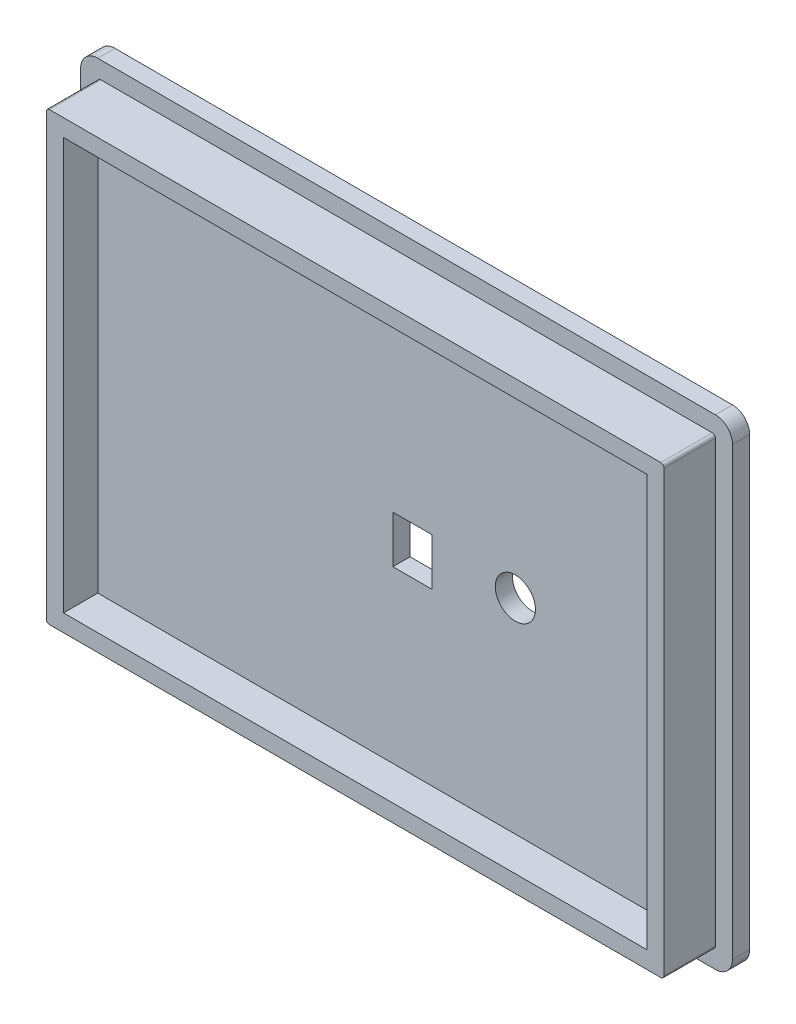
from build123d import *

# Parameters (mm, degrees)
SKETCH1_W           = 190
SKETCH1_H           = 140
BOSS_EXTRUDE1_DEPTH = 5
SKETCH2_W           = 160
SKETCH2_H           = 104
CUT_EXTRUDE1_DEPTH  = 5
SKETCH3_W           = 180
SKETCH3_H           = 130
BOSS_EXTRUDE2_DEPTH = 15
SKETCH4_W           = 170
SKETCH4_H           = 120
CUT_EXTRUDE2_DEPTH  = 10
FILLET1_R           = 0.9
FILLET2_R           = 0.9
SKETCH5_R           = 5.850988458
SKETCH5_W           = 11.444331631
SKETCH5_H           = 13.771992302
CUT_EXTRUDE3_DEPTH  = 10
FILLET3_R           = 5


with BuildPart() as part:
    # Sketch1 → Boss-Extrude1 (new body)
    with BuildSketch(Plane.XY):
        with Locations((-8.247588424, 0.40192926)):
            Rectangle(SKETCH1_W, SKETCH1_H)
    extrude(amount=BOSS_EXTRUDE1_DEPTH)

    # Sketch2 → Cut-Extrude1 (cut)
    with BuildSketch(Plane(origin=(0, 0, 0), x_dir=(-1, 0, 0), z_dir=(0, 0, -1))):
        with Locations((8.247588424, 0.40192926)):
            Rectangle(SKETCH2_W, SKETCH2_H)
    extrude(amount=-CUT_EXTRUDE1_DEPTH, mode=Mode.SUBTRACT)

    # Sketch3 → Boss-Extrude2 (add)
    with BuildSketch(Plane.XY.offset(5)):
        with Locations((-8.247588424, 0.40192926)):
            Rectangle(SKETCH3_W, SKETCH3_H)
    extrude(amount=BOSS_EXTRUDE2_DEPTH)

    # Sketch4 → Cut-Extrude2 (cut)
    with BuildSketch(Plane.XY.offset(20)):
        with Locations((-8.247588424, 0.40192926)):
            Rectangle(SKETCH4_W, SKETCH4_H)
    extrude(amount=-CUT_EXTRUDE2_DEPTH, mode=Mode.SUBTRACT)

    # Fillet1
    fillet1_edges = [part.edges().sort_by_distance(p)[0] for p in [
        (71.752411576, 0.40192926, 0),
        (-8.247588424, -51.59807074, 0),
        (-88.247588424, 0.40192926, 0),
        (-8.247588424, 52.40192926, 0),
    ]]
    fillet(fillet1_edges, radius=FILLET1_R)

    # Fillet2
    fillet2_edges = [part.edges().sort_by_distance(p)[0] for p in [
        (-98.247588424, 65.40192926, 12.5),
        (-98.247588424, -64.59807074, 12.5),
        (81.752411576, -64.59807074, 12.5),
        (81.752411576, 65.40192926, 12.5),
    ]]
    fillet(fillet2_edges, radius=FILLET2_R)

    # Sketch5 → Cut-Extrude3 (cut)
    with BuildSketch(Plane(origin=(0, 0, 5), x_dir=(-1, 0, 0), z_dir=(0, 0, -1))):
        with Locations((-28.456331926, 0)):
            Circle(SKETCH5_R)
        with Locations((1.51229921, -3.046296959)):
            Rectangle(SKETCH5_W, SKETCH5_H)
    extrude(amount=-CUT_EXTRUDE3_DEPTH, mode=Mode.SUBTRACT)

    # Fillet3
    fillet3_edges = [part.edges().sort_by_distance(p)[0] for p in [
        (-103.247588424, 70.40192926, 2.5),
        (86.752411576, 70.40192926, 2.5),
        (86.752411576, -69.59807074, 2.5),
        (-103.247588424, -69.59807074, 2.5),
    ]]
    fillet(fillet3_edges, radius=FILLET3_R)


solid = part.part
